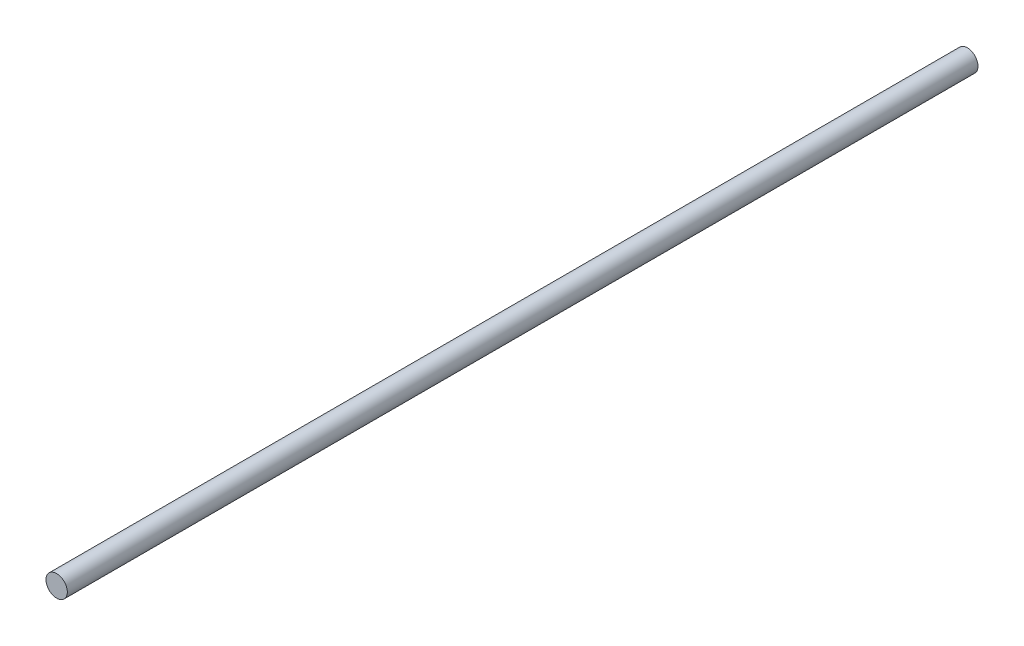
from build123d import *

# Parameters (mm, degrees)
SKETCH_1_R      = 3
EXTRUDE_1_DEPTH = 256


with BuildPart() as part:
    # 스케치1 → 보스-돌출1 (new body)
    with BuildSketch(Plane.XY):
        Circle(SKETCH_1_R)
    extrude(amount=EXTRUDE_1_DEPTH)


solid = part.part
